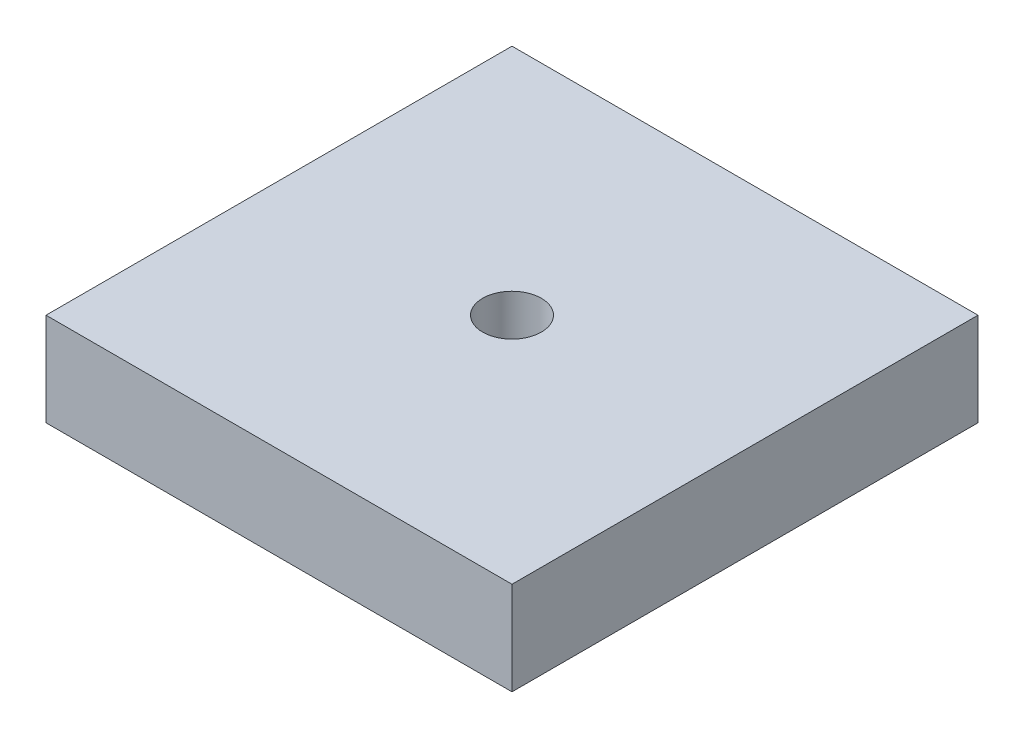
from build123d import *

# Parameters (mm, degrees)
SKETCH1_W           = 50
SKETCH1_H           = 50
BOSS_EXTRUDE1_DEPTH = 10
SKETCH2_R           = 3.15
CUT_EXTRUDE1_DEPTH  = 10


with BuildPart() as part:
    # Sketch1 → Boss-Extrude1 (new body)
    with BuildSketch(Plane(origin=(0, 0, 0), x_dir=(1, 0, 0), z_dir=(0, 1, 0))):
        Rectangle(SKETCH1_W, SKETCH1_H)
    extrude(amount=BOSS_EXTRUDE1_DEPTH)

    # Sketch2 → Cut-Extrude1 (cut)
    with BuildSketch(Plane(origin=(0, 10, 0), x_dir=(1, 0, 0), z_dir=(0, 1, 0))):
        with Locations(Location((0, 0, 0), (0, 0, 270))):
            Circle(SKETCH2_R)
    extrude(amount=-CUT_EXTRUDE1_DEPTH, mode=Mode.SUBTRACT)


solid = part.part
